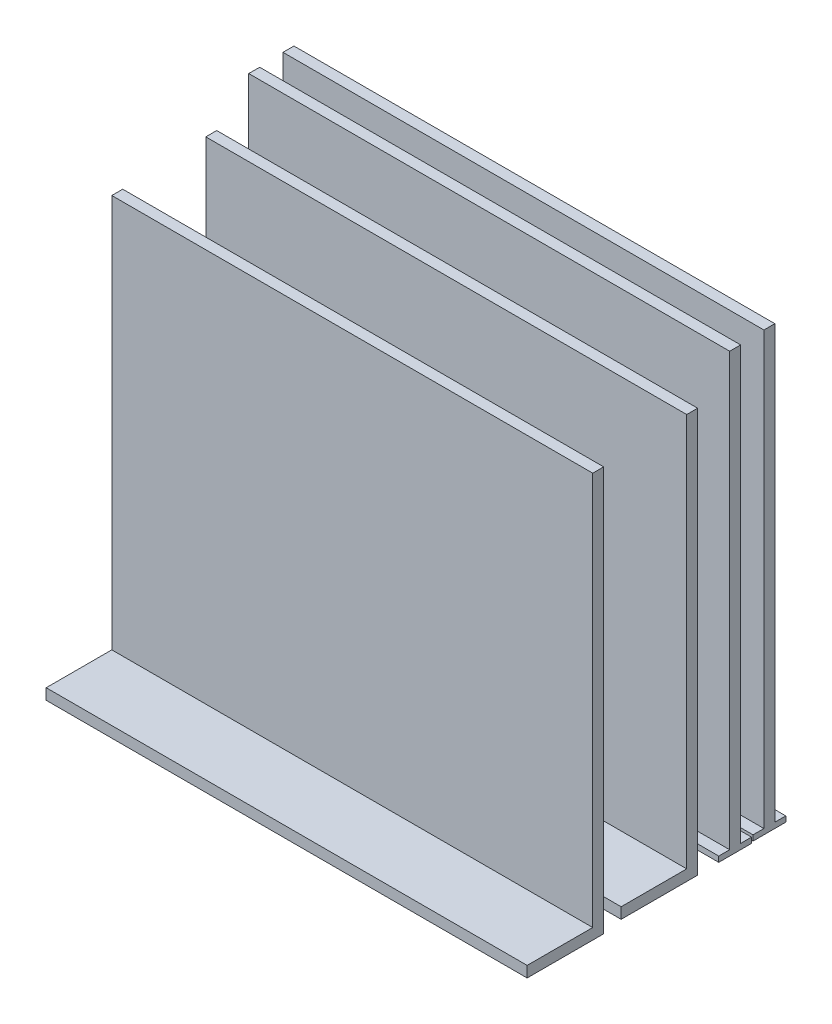
from build123d import *

# Parameters (mm, degrees)
SKETCH_1_W      = 220
SKETCH_1_H      = 5
EXTRUDE_1_DEPTH = 200
SKETCH_4_W      = 220
SKETCH_4_H      = 5
EXTRUDE_2_DEPTH = 200
SKETCH_5_W      = 220
SKETCH_5_H      = 5
EXTRUDE_3_DEPTH = 185
SKETCH_8_W      = 220
SKETCH_8_H      = 5
EXTRUDE_5_DEPTH = 185
SKETCH_9_W      = 220
SKETCH_9_H      = 30
EXTRUDE_6_DEPTH = 5
SKETCH_12_W     = 220
SKETCH_12_H     = 5
EXTRUDE_8_DEPTH = 2.5


with BuildPart() as part:
    # 草图1 → 凸台-拉伸1 (new body)
    with BuildSketch(Plane(origin=(0, 0, 0), x_dir=(1, 0, 0), z_dir=(0, 1, 0))):
        Rectangle(SKETCH_1_W, SKETCH_1_H)
    extrude(amount=EXTRUDE_1_DEPTH)



with BuildPart() as body_2:
    # 草图4 → 凸台-拉伸2 (new body)
    with BuildSketch(Plane(origin=(0, 0, 0), x_dir=(1, 0, 0), z_dir=(0, 1, 0))):
        with Locations((0.575234316, -16.245858739)):
            Rectangle(SKETCH_4_W, SKETCH_4_H)
    extrude(amount=EXTRUDE_2_DEPTH)


with BuildPart() as body_3:
    # 草图5 → 凸台-拉伸3 (new body)
    with BuildSketch(Plane(origin=(0, 0, 0), x_dir=(1, 0, 0), z_dir=(0, 1, 0))):
        with Locations((0.828556731, -36.149941631)):
            Rectangle(SKETCH_5_W, SKETCH_5_H)
    extrude(amount=EXTRUDE_3_DEPTH)



with BuildPart() as body_4:
    # 草图8 → 凸台-拉伸5 (new body)
    with BuildSketch(Plane(origin=(0, 0, 0), x_dir=(1, 0, 0), z_dir=(0, 1, 0))):
        with Locations((2.56272571, -80.880026671)):
            Rectangle(SKETCH_8_W, SKETCH_8_H)
    extrude(amount=EXTRUDE_5_DEPTH)


with BuildPart() as body_3_1:
    add(body_3.part)

    add(body_4.part)  # 凸台-拉伸6 merges body 4
    # 草图9 → 凸台-拉伸6 (add)
    with BuildSketch(Plane(origin=(0, 0, 0), x_dir=(1, 0, 0), z_dir=(0, 1, 0))):
        with Locations((0.828556731, -53.649941631)):
            Rectangle(SKETCH_9_W, SKETCH_9_H)
        with Locations((2.56272571, -98.380026671)):
            Rectangle(SKETCH_9_W, SKETCH_9_H)
    extrude(amount=EXTRUDE_6_DEPTH)


with BuildPart() as part_1:
    add(part.part)

    add(body_2.part)  # 凸台-拉伸8 merges body 2
    # 草图12 → 凸台-拉伸8 (add)
    with BuildSketch(Plane(origin=(0, 0, 0), x_dir=(1, 0, 0), z_dir=(0, 1, 0))):
        with Locations((0.575234316, -21.245858739)):
            Rectangle(SKETCH_12_W, SKETCH_12_H)
        with Locations((0.575234316, -11.245858739)):
            Rectangle(SKETCH_12_W, SKETCH_12_H)
        with Locations((0, -5)):
            Rectangle(SKETCH_12_W, SKETCH_12_H)
        with Locations((0, 5)):
            Rectangle(SKETCH_12_W, SKETCH_12_H)
    extrude(amount=EXTRUDE_8_DEPTH)


solid = Compound([body_3_1.part, part_1.part])
